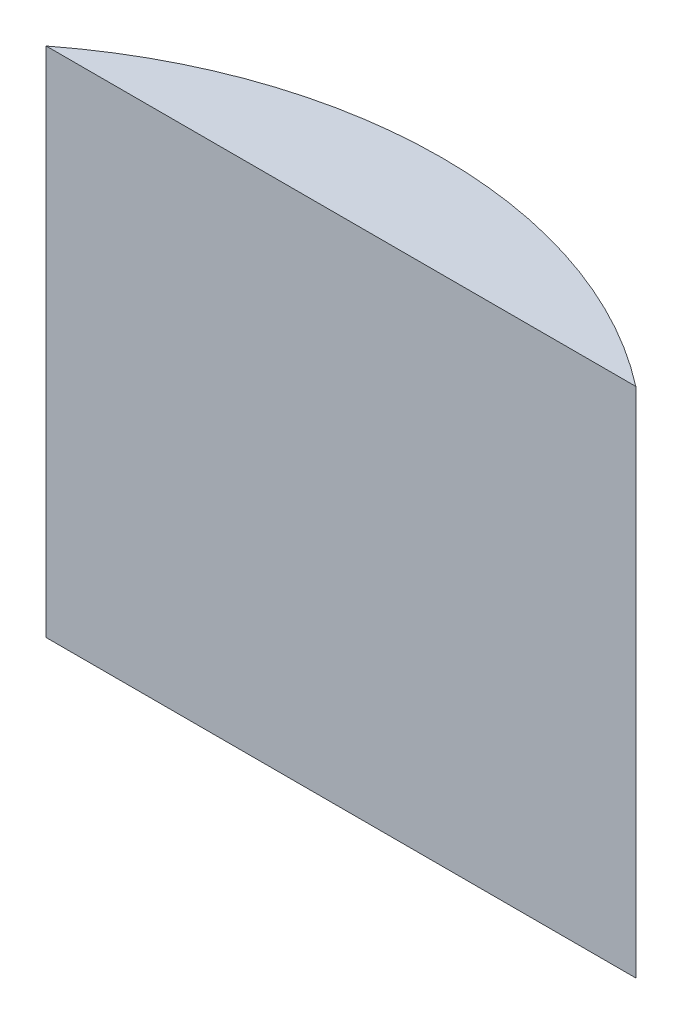
from build123d import *

# Parameters (mm, degrees)
SKETCH1_R               = 25.7
MAIN_CYLINDER_DEPTH     = 100
MAIN_START              = -98
MAIN_CUT_DOWN_DEPTH     = 98
BOSS_EXTRUDE1_DEPTH     = 20
CUT_EXTRUDE1_DEPTH      = 43.485056196
CUT_EXTRUDE1_DEPTH_BACK = 43.485056196
SKETCH9_W               = 59.759495022
SKETCH9_H               = 2


with BuildPart() as part:
    # Sketch1 → Main Cylinder (new body)
    with BuildSketch(Plane(origin=(0, 0, 0), x_dir=(1, 0, 0), z_dir=(0, 1, 0))):
        with Locations(Location((0, 0, 0), (0, 0, 270))):
            Circle(SKETCH1_R)
    extrude(amount=MAIN_CYLINDER_DEPTH)

    # Sketch4 → Main cut down (cut)
    with BuildSketch(Plane(origin=(0, 100, 0), x_dir=(1, 0, 0), z_dir=(0, 1, 0)).offset(MAIN_START)):
        with BuildLine():
            Line((-25.7, 0), (0, 0))
            Line((0, 0), (25.7, 0))
            ThreePointArc((25.7, 0), (0, 25.7), (-25.7, 0))
        make_face()
        with BuildLine():
            Line((25.7, 0), (0, 0))
            Line((0, 0), (-25.7, 0))
            ThreePointArc((-25.7, 0), (0, -25.7), (25.7, 0))
        make_face()
    extrude(amount=MAIN_CUT_DOWN_DEPTH, mode=Mode.SUBTRACT)

    # Sketch8 → Boss-Extrude1 (add)
    with BuildSketch(Plane(origin=(0, 2, 0), x_dir=(1, 0, 0), z_dir=(0, 1, 0))):
        with BuildLine():
            Line((-11.5075562, 14.8), (11.5075562, 14.8))
            ThreePointArc((11.5075562, 14.8), (0, 18.747369141), (-11.5075562, 14.8))
        make_face()
    extrude(amount=BOSS_EXTRUDE1_DEPTH)

    # Sketch9 → Cut-Extrude1 (cut, two sides: drawn at the far end of the back side and taken through both)
    with BuildSketch(Plane.XY.offset(-CUT_EXTRUDE1_DEPTH_BACK)):
        with Locations((-0.511377988, 1)):
            Rectangle(SKETCH9_W, SKETCH9_H)
    extrude(amount=CUT_EXTRUDE1_DEPTH + CUT_EXTRUDE1_DEPTH_BACK, mode=Mode.SUBTRACT)


solid = part.part
